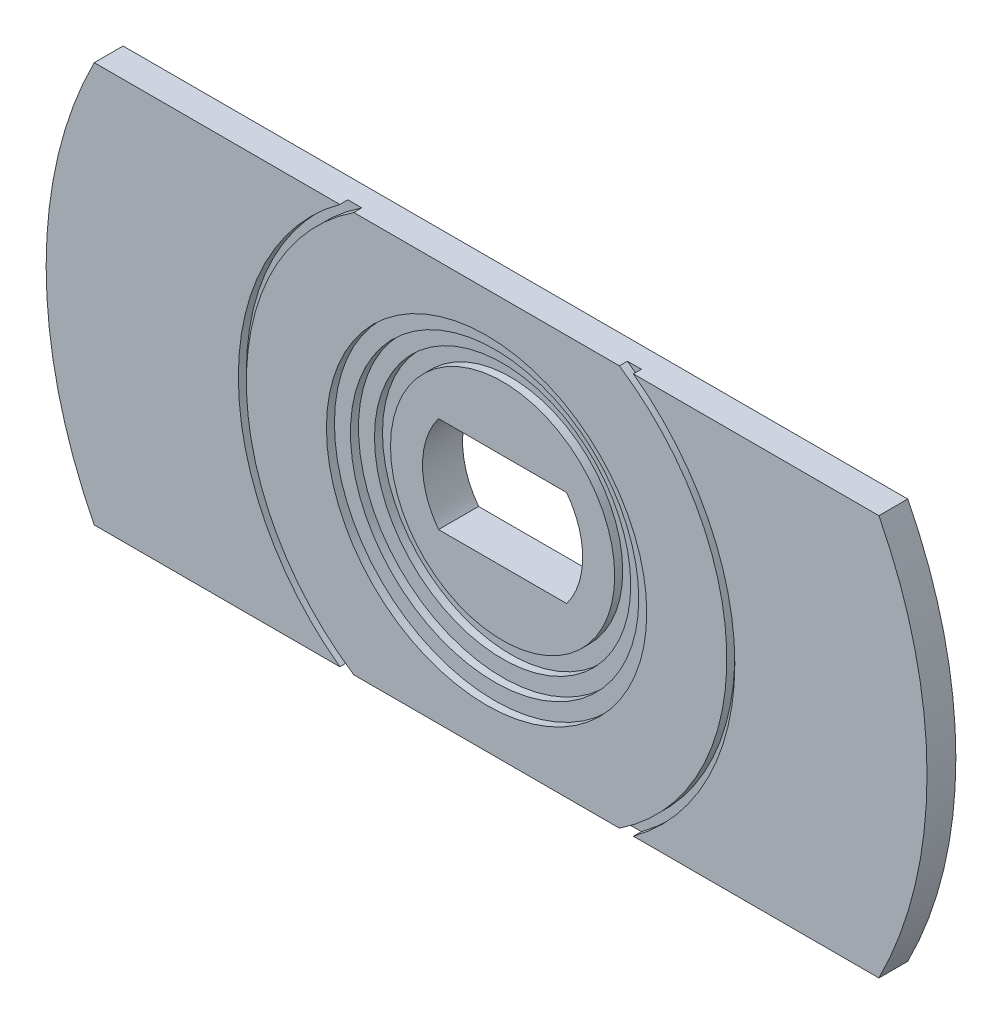
from build123d import *

# Parameters (mm, degrees)
CUT_EXTRUDE_START    = -1.8
CUT_EXTRUDE_1_DEPTH  = 1.8
EXTRUDE_1_DEPTH      = 0.5
EXTRUDE_1_DEPTH_BACK = 2
SKETCH_3_R           = 7


with BuildPart() as part:
    # Эскиз1 → Повернуть1 (revolve)
    with BuildSketch(Plane(origin=(0, 0, 0), x_dir=(0, 0, -1), z_dir=(1, 0, 0)), mode=Mode.PRIVATE) as revolve_1_sk:
        Polygon((1.5, 7), (1.5, 8), (1, 8), (1, 9), (0.5, 9), (0.5, 10), (0, 10), (0, 15), (0.5, 15), (0.5, 15.5), (0, 15.5), (0, 27.5), (1.8, 27.5), (1.8, 7), align=None)
    revolve(revolve_1_sk.sketch.rotate(Axis((0, 0, 1.483516484), (0, 0, -1)), 90), axis=Axis((0, 0, 1.483516484), (0, 0, -1)))

    # Эскиз2 → Вырез-Вытянуть1 (cut)
    with BuildSketch(Plane.XY.offset(CUT_EXTRUDE_START)):
        with BuildLine():
            Line((-24.494897428, 12.5), (24.494897428, 12.5))
            ThreePointArc((24.494897428, 12.5), (0, 27.5), (-24.494897428, 12.5))
        make_face()
        with BuildLine():
            Line((-24.494897428, -12.5), (24.494897428, -12.5))
            ThreePointArc((24.494897428, -12.5), (0, -27.5), (-24.494897428, -12.5))
        make_face()
    extrude(amount=CUT_EXTRUDE_1_DEPTH, mode=Mode.SUBTRACT)

    # Эскиз3 → Бобышка-Вытянуть1 (add, two sides: drawn at the far end of the back side and taken through both)
    with BuildSketch(Plane.XY.offset(-1.5).offset(-EXTRUDE_1_DEPTH_BACK)):
        Circle(SKETCH_3_R)
        with BuildLine():
            Line((4, 3), (-4, 3))
            ThreePointArc((-4, 3), (-5, 0), (-4, -3))
            Line((-4, -3), (4, -3))
            ThreePointArc((4, -3), (5, 0), (4, 3))
        make_face(mode=Mode.SUBTRACT)
    extrude(amount=EXTRUDE_1_DEPTH + EXTRUDE_1_DEPTH_BACK)


solid = part.part
